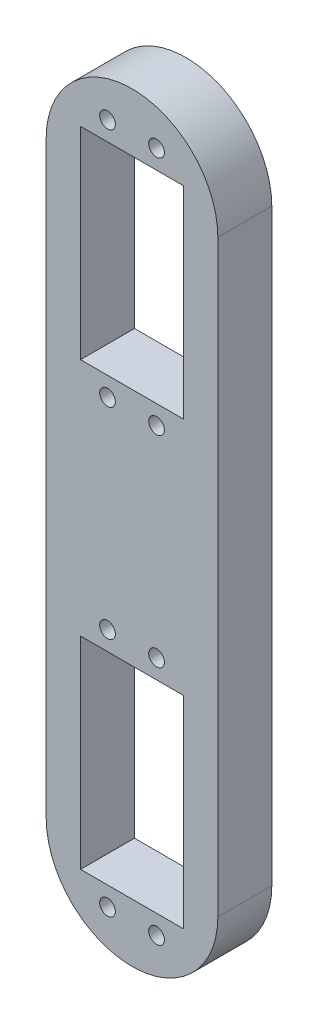
from build123d import *

# Parameters (mm, degrees)
SKETCH1_R           = 1.6
SKETCH1_W           = 21
SKETCH1_H           = 41
BOSS_EXTRUDE1_DEPTH = 11
SKETCH6_W           = 21
SKETCH6_H           = 0.1
CUT_EXTRUDE1_DEPTH  = 91.428148273
SKETCH7_W           = 21
SKETCH7_H           = 41.2
SKETCH7_R           = 1.6
CUT_EXTRUDE2_DEPTH  = 11


with BuildPart() as part:
    # Sketch1 → Boss-Extrude1 (new body)
    with BuildSketch(Plane.XY):
        with BuildLine():
            Line((-20, 70), (-20, -50))
            ThreePointArc((-20, -50), (-2.5, -67.5), (15, -50))
            Line((15, -50), (15, 70))
            ThreePointArc((15, 70), (-2.5, 87.5), (-20, 70))
        make_face()
        with Locations((-7.5, 79.5)):
            Circle(SKETCH1_R, mode=Mode.SUBTRACT)
        with Locations(Location((2.5, 79.5, 0), (0, 0, 180))):
            Circle(SKETCH1_R, mode=Mode.SUBTRACT)
        with Locations((2.5, 30.5)):
            Circle(SKETCH1_R, mode=Mode.SUBTRACT)
        with Locations(Location((-7.5, 30.5, 0), (0, 0, 180))):
            Circle(SKETCH1_R, mode=Mode.SUBTRACT)
        with Locations((-2.5, 55)):
            Rectangle(SKETCH1_W, SKETCH1_H, mode=Mode.SUBTRACT)
    extrude(amount=BOSS_EXTRUDE1_DEPTH)

    # Sketch6 → Cut-Extrude1 (cut, through all)
    with BuildSketch(Plane.XY.offset(11)):
        with Locations((-2.5, 75.55)):
            Rectangle(SKETCH6_W, SKETCH6_H)
        with Locations((-2.5, 34.45)):
            Rectangle(SKETCH6_W, SKETCH6_H)
    extrude(amount=-CUT_EXTRUDE1_DEPTH, mode=Mode.SUBTRACT)

    # Sketch7 → Cut-Extrude2 (cut)
    with BuildSketch(Plane(origin=(0, 0, 0), x_dir=(-1, 0, 0), z_dir=(0, 0, -1))):
        with Locations((2.5, -35)):
            Rectangle(SKETCH7_W, SKETCH7_H)
        with Locations((-2.5, -10.5)):
            Circle(SKETCH7_R)
        with Locations((7.5, -10.5)):
            Circle(SKETCH7_R)
        with Locations((-2.5, -59.5)):
            Circle(SKETCH7_R)
        with Locations((7.5, -59.5)):
            Circle(SKETCH7_R)
    extrude(amount=-CUT_EXTRUDE2_DEPTH, mode=Mode.SUBTRACT)


solid = part.part
